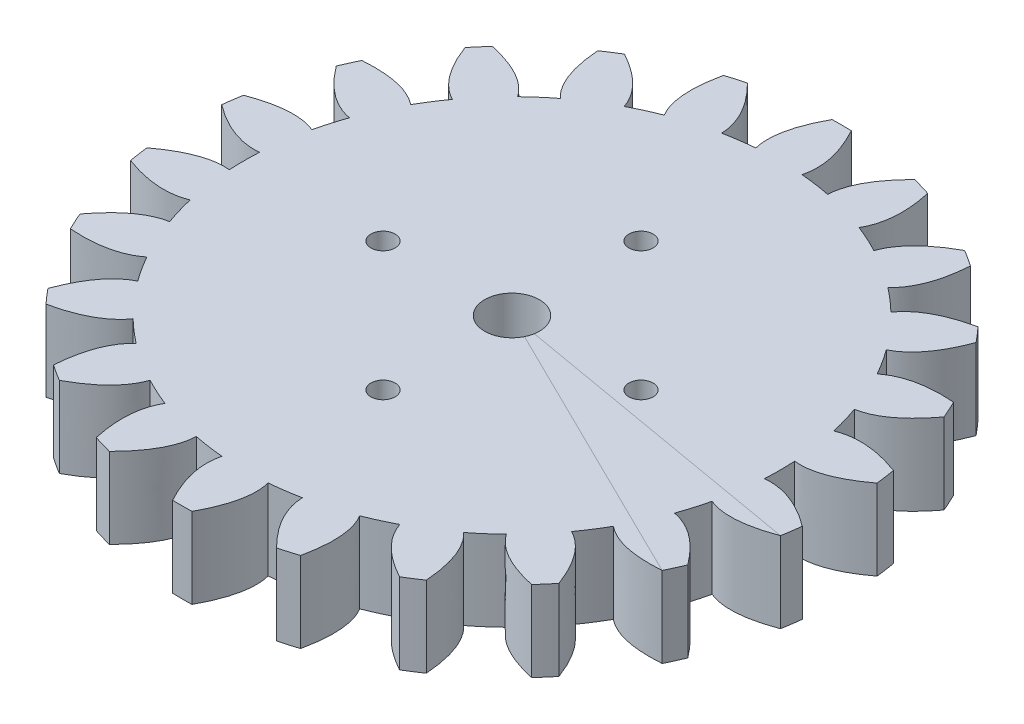
from build123d import *

# Parameters (mm, degrees)
SKETCH_1_W           = 20.454545455
SKETCH_1_H           = 5
CUT_EXTRUDE_1_DEPTH  = 30.356036168
CUT_EXTRUDE_2_DEPTH  = 30.356036325
CUT_EXTRUDE_START    = -10
CUT_EXTRUDE_24_DEPTH = 10
EXTRUDE_1_DEPTH      = 5
SKETCH_30_R          = 10.5
CUT_EXTRUDE_26_DEPTH = 2.5
SKETCH_31_R          = 0.75
SKETCH_31_R_2        = 1.7
CUT_EXTRUDE_27_DEPTH = 2.5
CUT_EXTRUDE_28_DEPTH = 3


with BuildPart() as part:
    # 草图1 → 旋转1 (revolve)
    with BuildSketch(Plane(origin=(0, 0, 0), x_dir=(-1, 0, 0), z_dir=(0, 0, -1)), mode=Mode.PRIVATE) as revolve_1_sk:
        with Locations((-10.227272728, -2.5)):
            Rectangle(SKETCH_1_W, SKETCH_1_H)
    revolve(revolve_1_sk.sketch.rotate(Axis((0, -5, 0), (0, 1, 0)), 270), axis=Axis((0, -5, 0), (0, 1, 0)))

    # 草图2 → 切除-拉伸1 (cut, through all)
    with BuildSketch(Plane(origin=(0, 0, 0), x_dir=(-1, 0, 0), z_dir=(0, 1, 0))):
        with BuildLine():
            ThreePointArc((-16.18506036, 3.774328811), (-15.946119022, 4.682203004), (-15.656295421, 5.575136817))
            add(Edge.make_bspline(
                [(-18.847521886, 7.947285605), (-17.290153908, 5.865702018), (-15.656295421, 5.575136817)],
                knots=[5.954734262, 5.954734262, 5.954734262, 6.237026865, 6.237026865, 6.237026865], degree=2, weights=[1, 0.990055387, 1]))
            ThreePointArc((-18.847521886, 7.947285605), (-19.625992643, 5.762711388), (-20.152171359, 3.504057543))
            add(Edge.make_bspline(
                [(-16.18506036, 3.774328811), (-17.716640991, 4.413220397), (-20.152171359, 3.504057543)],
                knots=[3.187751096, 3.187751096, 3.187751096, 3.470043699, 3.470043699, 3.470043699], degree=2, weights=[1, 0.990055387, 1]))
        make_face()
    extrude(amount=-CUT_EXTRUDE_1_DEPTH, mode=Mode.SUBTRACT)

    # 草图3 → 切除-拉伸2 (cut, through all)
    with BuildSketch(Plane(origin=(0, 0, 0), x_dir=(-1, 0, 0), z_dir=(0, 1, 0))):
        with BuildLine():
            ThreePointArc((-14.466100387, 8.181300412), (-13.981060134, 8.985081767), (-13.451407899, 9.760192742))
            add(Edge.make_bspline(
                [(-15.845055727, 12.935325229), (-14.93722196, 10.49929914), (-13.451407899, 9.760192742)],
                knots=[5.954734262, 5.954734262, 5.954734262, 6.237026865, 6.237026865, 6.237026865], degree=2, weights=[1, 0.990055387, 1]))
            ThreePointArc((-15.845055727, 12.935325229), (-17.207458626, 11.058562175), (-18.348659729, 9.039641359))
            add(Edge.make_bspline(
                [(-14.466100387, 8.181300412), (-15.755644681, 9.225808528), (-18.348659729, 9.039641359)],
                knots=[3.187751096, 3.187751096, 3.187751096, 3.470043698, 3.470043698, 3.470043698], degree=2, weights=[1, 0.990055387, 1]))
        make_face()
    extrude(amount=-CUT_EXTRUDE_2_DEPTH, mode=Mode.SUBTRACT)

    # 草图28 → 切除-拉伸24 (cut)
    with BuildSketch(Plane(origin=(0, 0, 0), x_dir=(1, 0, 0), z_dir=(0, 1, 0)).offset(CUT_EXTRUDE_START)):
        with BuildLine():
            Line((20.152171359, -3.504057543), (0, 0))
            Line((0, 0), (18.348659729, -9.039641359))
            ThreePointArc((18.348659729, -9.039641359), (-19.448371928, 6.3363443), (20.152171359, -3.504057543))
        make_face()
    extrude(amount=CUT_EXTRUDE_24_DEPTH, mode=Mode.SUBTRACT)


with BuildPart() as body_2:
    # 草图29 → 凸台-拉伸1 (new body)
    with BuildSketch(Plane(origin=(0, 0, 0), x_dir=(1, 0, 0), z_dir=(0, 1, 0))):
        with BuildLine():
            Line((0, 0), (20.152171359, -3.504057543))
            ThreePointArc((20.152171359, -3.504057543), (20.246347675, -2.910985324), (20.323073914, -2.315404162))
            add(Edge.make_bspline(
                [(20.323073914, -2.315404162), (18.242340415, -0.756900598), (16.592803, -0.938416459)],
                knots=[5.954734262, 5.954734262, 5.954734262, 6.237026865, 6.237026865, 6.237026865], degree=2, weights=[1, 0.990055387, 1]))
            ThreePointArc((16.592803, -0.938416459), (16.619318182, 4e-09), (16.592803, 0.938416468))
            add(Edge.make_bspline(
                [(16.592803, 0.938416468), (18.242340414, 0.756900608), (20.323073914, 2.315404175)],
                knots=[0.046158443, 0.046158443, 0.046158443, 0.328451045, 0.328451045, 0.328451045], degree=2, weights=[1, 0.990055387, 1]))
            ThreePointArc((20.323073914, 2.315404175), (20.246347675, 2.910985337), (20.152171358, 3.504057557))
            add(Edge.make_bspline(
                [(20.152171358, 3.504057557), (17.716640992, 4.413220407), (16.18506036, 3.77432882)],
                knots=[2.813141609, 2.813141609, 2.813141609, 3.095434211, 3.095434211, 3.095434211], degree=2, weights=[1, 0.990055387, 1]))
            ThreePointArc((16.18506036, 3.77432882), (15.946119021, 4.682203013), (15.656295421, 5.575136826))
            add(Edge.make_bspline(
                [(15.656295421, 5.575136826), (17.290153907, 5.865702027), (18.847521885, 7.947285618)],
                knots=[3.187751096, 3.187751096, 3.187751096, 3.470043699, 3.470043699, 3.470043699], degree=2, weights=[1, 0.990055387, 1]))
            ThreePointArc((18.847521885, 7.947285618), (18.606108994, 8.497125279), (18.348659728, 9.039641372))
            add(Edge.make_bspline(
                [(18.348659728, 9.039641372), (15.755644679, 9.225808541), (14.466100385, 8.181300425)],
                knots=[2.813141609, 2.813141609, 2.813141609, 3.095434211, 3.095434211, 3.095434211], degree=2, weights=[1, 0.990055387, 1]))
            ThreePointArc((14.466100385, 8.181300425), (13.981060132, 8.98508178), (13.451407897, 9.760192755))
            add(Edge.make_bspline(
                [(13.451407897, 9.760192755), (14.937221957, 10.499299153), (15.845055722, 12.935325245)],
                knots=[0.046158443, 0.046158443, 0.046158443, 0.328451045, 0.328451045, 0.328451045], degree=2, weights=[1, 0.990055387, 1]))
            ThreePointArc((15.845055722, 12.935325245), (15.458514016, 13.394878665), (15.058648808, 13.842887204))
            add(Edge.make_bspline(
                [(15.058648808, 13.842887204), (12.518219736, 13.290976535), (11.575182989, 11.925471726)],
                knots=[5.954734262, 5.954734262, 5.954734262, 6.237026865, 6.237026865, 6.237026865], degree=2, weights=[1, 0.990055387, 1]))
            ThreePointArc((11.575182989, 11.925471726), (10.883338897, 12.560042658), (10.156767303, 13.154535914))
            add(Edge.make_bspline(
                [(10.156767303, 13.154535914), (11.374165119, 14.282305504), (11.558917378, 16.87542175)],
                knots=[0.046158443, 0.046158443, 0.046158443, 0.328451045, 0.328451045, 0.328451045], degree=2, weights=[1, 0.990055387, 1]))
            ThreePointArc((11.558917378, 16.87542175), (11.058562167, 17.207458644), (10.548675718, 17.524664643))
            add(Edge.make_bspline(
                [(10.548675718, 17.524664643), (8.266643078, 16.279388656), (7.746513106, 14.703512232)],
                knots=[5.954734262, 5.954734262, 5.954734262, 6.237026865, 6.237026865, 6.237026865], degree=2, weights=[1, 0.990055387, 1]))
            ThreePointArc((7.746513106, 14.703512232), (6.90391427, 15.117463577), (6.039285825, 15.483176807))
            add(Edge.make_bspline(
                [(6.039285825, 15.483176807), (6.889641066, 16.908244403), (6.33634429, 19.448371948)],
                knots=[0.046158443, 0.046158443, 0.046158443, 0.328451045, 0.328451045, 0.328451045], degree=2, weights=[1, 0.990055387, 1]))
            ThreePointArc((6.33634429, 19.448371948), (5.762711378, 19.625992662), (5.184111655, 19.786697975))
            add(Edge.make_bspline(
                [(5.184111655, 19.786697975), (3.345352159, 17.948941525), (3.2902668, 16.290361622)],
                knots=[5.954734262, 5.954734262, 5.954734262, 6.237026865, 6.237026865, 6.237026865], degree=2, weights=[1, 0.990055387, 1]))
            ThreePointArc((3.2902668, 16.290361622), (2.365175567, 16.450157505), (1.432537326, 16.557462797))
            add(Edge.make_bspline(
                [(1.432537326, 16.557462797), (1.846959267, 18.164377898), (0.60043827, 20.445730714)],
                knots=[3.187751096, 3.187751096, 3.187751096, 3.470043699, 3.470043699, 3.470043699], degree=2, weights=[1, 0.990055387, 1]))
            ThreePointArc((0.60043827, 20.445730714), (-1.7e-08, 20.454545474), (-0.600438303, 20.445730714))
            add(Edge.make_bspline(
                [(-0.600438303, 20.445730714), (-1.846959297, 18.164377899), (-1.432537355, 16.557462797)],
                knots=[5.954734262, 5.954734262, 5.954734262, 6.237026865, 6.237026865, 6.237026865], degree=2, weights=[1, 0.990055387, 1]))
            ThreePointArc((-1.432537355, 16.557462797), (-2.365175596, 16.450157505), (-3.290266829, 16.290361622))
            add(Edge.make_bspline(
                [(-3.290266829, 16.290361622), (-3.345352189, 17.948941525), (-5.184111689, 19.786697974)],
                knots=[0.046158443, 0.046158443, 0.046158443, 0.328451045, 0.328451045, 0.328451045], degree=2, weights=[1, 0.990055387, 1]))
            ThreePointArc((-5.184111689, 19.786697974), (-5.762711411, 19.625992661), (-6.336344323, 19.448371947))
            add(Edge.make_bspline(
                [(-6.336344323, 19.448371947), (-6.889641096, 16.908244403), (-6.039285855, 15.483176807)],
                knots=[5.954734262, 5.954734262, 5.954734262, 6.237026865, 6.237026865, 6.237026865], degree=2, weights=[1, 0.990055387, 1]))
            ThreePointArc((-6.039285855, 15.483176807), (-6.903914299, 15.117463578), (-7.746513135, 14.703512232))
            add(Edge.make_bspline(
                [(-7.746513135, 14.703512232), (-8.266643107, 16.279388655), (-10.548675751, 17.524664641)],
                knots=[0.046158443, 0.046158443, 0.046158443, 0.328451045, 0.328451045, 0.328451045], degree=2, weights=[1, 0.990055387, 1]))
            ThreePointArc((-10.548675751, 17.524664641), (-11.0585622, 17.207458642), (-11.558917411, 16.875421748))
            add(Edge.make_bspline(
                [(-11.558917411, 16.875421748), (-11.374165149, 14.282305504), (-10.156767332, 13.154535915)],
                knots=[2.813141609, 2.813141609, 2.813141609, 3.095434211, 3.095434211, 3.095434211], degree=2, weights=[1, 0.990055387, 1]))
            ThreePointArc((-10.156767332, 13.154535915), (-10.883338927, 12.560042658), (-11.575183018, 11.925471727))
            add(Edge.make_bspline(
                [(-11.575183018, 11.925471727), (-12.518219766, 13.290976535), (-15.05864884, 13.842887201)],
                knots=[0.046158443, 0.046158443, 0.046158443, 0.328451045, 0.328451045, 0.328451045], degree=2, weights=[1, 0.990055387, 1]))
            ThreePointArc((-15.05864884, 13.842887201), (-15.458514048, 13.394878662), (-15.845055754, 12.935325242))
            add(Edge.make_bspline(
                [(-15.845055754, 12.935325242), (-14.937221988, 10.499299153), (-13.451407926, 9.760192756)],
                knots=[5.954734262, 5.954734262, 5.954734262, 6.237026865, 6.237026865, 6.237026865], degree=2, weights=[1, 0.990055387, 1]))
            ThreePointArc((-13.451407926, 9.760192756), (-13.981060161, 8.985081781), (-14.466100414, 8.181300426))
            add(Edge.make_bspline(
                [(-14.466100414, 8.181300426), (-15.755644709, 9.22580854), (-18.348659759, 9.039641368)],
                knots=[0.046158443, 0.046158443, 0.046158443, 0.328451045, 0.328451045, 0.328451045], degree=2, weights=[1, 0.990055387, 1]))
            ThreePointArc((-18.348659759, 9.039641368), (-18.606109025, 8.497125275), (-18.847521916, 7.947285615))
            add(Edge.make_bspline(
                [(-18.847521916, 7.947285615), (-17.290153937, 5.865702027), (-15.65629545, 5.575136826)],
                knots=[5.954734262, 5.954734262, 5.954734262, 6.237026865, 6.237026865, 6.237026865], degree=2, weights=[1, 0.990055387, 1]))
            ThreePointArc((-15.65629545, 5.575136826), (-15.946119051, 4.682203014), (-16.18506039, 3.77432882))
            add(Edge.make_bspline(
                [(-16.18506039, 3.77432882), (-17.716641021, 4.413220406), (-20.152171389, 3.504057553)],
                knots=[0.046158443, 0.046158443, 0.046158443, 0.328451045, 0.328451045, 0.328451045], degree=2, weights=[1, 0.990055387, 1]))
            ThreePointArc((-20.152171389, 3.504057553), (-20.246347705, 2.910985333), (-20.323073944, 2.315404171))
            add(Edge.make_bspline(
                [(-20.323073944, 2.315404171), (-18.242340445, 0.756900608), (-16.59280303, 0.938416468)],
                knots=[2.813141609, 2.813141609, 2.813141609, 3.095434211, 3.095434211, 3.095434211], degree=2, weights=[1, 0.990055387, 1]))
            ThreePointArc((-16.59280303, 0.938416468), (-16.619318212, 5e-09), (-16.59280303, -0.938416458))
            add(Edge.make_bspline(
                [(-16.59280303, -0.938416458), (-18.242340444, -0.756900598), (-20.323073943, -2.315404166)],
                knots=[3.187751096, 3.187751096, 3.187751096, 3.470043699, 3.470043699, 3.470043699], degree=2, weights=[1, 0.990055387, 1]))
            ThreePointArc((-20.323073943, -2.315404166), (-20.246347705, -2.910985328), (-20.152171388, -3.504057547))
            add(Edge.make_bspline(
                [(-20.152171388, -3.504057547), (-17.716641022, -4.413220397), (-16.18506039, -3.774328811)],
                knots=[2.813141609, 2.813141609, 2.813141609, 3.095434211, 3.095434211, 3.095434211], degree=2, weights=[1, 0.990055387, 1]))
            ThreePointArc((-16.18506039, -3.774328811), (-15.946119052, -4.682203004), (-15.65629545, -5.575136817))
            add(Edge.make_bspline(
                [(-15.65629545, -5.575136817), (-17.290153937, -5.865702018), (-18.847521915, -7.947285609)],
                knots=[0.046158443, 0.046158443, 0.046158443, 0.328451045, 0.328451045, 0.328451045], degree=2, weights=[1, 0.990055387, 1]))
            ThreePointArc((-18.847521915, -7.947285609), (-18.606109024, -8.497125269), (-18.348659757, -9.039641362))
            add(Edge.make_bspline(
                [(-18.348659757, -9.039641362), (-15.755644709, -9.225808531), (-14.466100415, -8.181300416)],
                knots=[5.954734262, 5.954734262, 5.954734262, 6.237026865, 6.237026865, 6.237026865], degree=2, weights=[1, 0.990055387, 1]))
            ThreePointArc((-14.466100415, -8.181300416), (-13.981060162, -8.985081771), (-13.451407927, -9.760192746))
            add(Edge.make_bspline(
                [(-13.451407927, -9.760192746), (-14.937221987, -10.499299143), (-15.845055752, -12.935325236)],
                knots=[0.046158443, 0.046158443, 0.046158443, 0.328451045, 0.328451045, 0.328451045], degree=2, weights=[1, 0.990055387, 1]))
            ThreePointArc((-15.845055752, -12.935325236), (-15.458514046, -13.394878656), (-15.058648838, -13.842887195))
            add(Edge.make_bspline(
                [(-15.058648838, -13.842887195), (-12.518219766, -13.290976526), (-11.575183018, -11.925471717)],
                knots=[5.954734262, 5.954734262, 5.954734262, 6.237026865, 6.237026865, 6.237026865], degree=2, weights=[1, 0.990055387, 1]))
            ThreePointArc((-11.575183018, -11.925471717), (-10.883338928, -12.560042649), (-10.156767333, -13.154535905))
            add(Edge.make_bspline(
                [(-10.156767333, -13.154535905), (-11.374165149, -14.282305494), (-11.558917407, -16.875421741)],
                knots=[3.187751096, 3.187751096, 3.187751096, 3.470043699, 3.470043699, 3.470043699], degree=2, weights=[1, 0.990055387, 1]))
            ThreePointArc((-11.558917407, -16.875421741), (-11.058562197, -17.207458636), (-10.548675748, -17.524664633))
            add(Edge.make_bspline(
                [(-10.548675748, -17.524664633), (-8.266643107, -16.279388647), (-7.746513135, -14.703512223)],
                knots=[5.954734262, 5.954734262, 5.954734262, 6.237026865, 6.237026865, 6.237026865], degree=2, weights=[1, 0.990055387, 1]))
            ThreePointArc((-7.746513135, -14.703512223), (-6.903914301, -15.117463569), (-6.039285855, -15.483176797))
            add(Edge.make_bspline(
                [(-6.039285855, -15.483176797), (-6.889641096, -16.908244394), (-6.33634432, -19.448371938)],
                knots=[0.046158443, 0.046158443, 0.046158443, 0.328451045, 0.328451045, 0.328451045], degree=2, weights=[1, 0.990055387, 1]))
            ThreePointArc((-6.33634432, -19.448371938), (-5.762711407, -19.625992653), (-5.184111685, -19.786697966))
            add(Edge.make_bspline(
                [(-5.184111685, -19.786697966), (-3.345352189, -17.948941516), (-3.29026683, -16.290361613)],
                knots=[5.954734262, 5.954734262, 5.954734262, 6.237026865, 6.237026865, 6.237026865], degree=2, weights=[1, 0.990055387, 1]))
            ThreePointArc((-3.29026683, -16.290361613), (-2.365175597, -16.450157497), (-1.432537356, -16.557462787))
            add(Edge.make_bspline(
                [(-1.432537356, -16.557462787), (-1.846959296, -18.164377889), (-0.6004383, -20.445730705)],
                knots=[3.187751096, 3.187751096, 3.187751096, 3.470043699, 3.470043699, 3.470043699], degree=2, weights=[1, 0.990055387, 1]))
            ThreePointArc((-0.6004383, -20.445730705), (-1.3e-08, -20.454545466), (0.600438274, -20.445730705))
            add(Edge.make_bspline(
                [(0.600438274, -20.445730705), (1.846959267, -18.16437789), (1.432537325, -16.557462787)],
                knots=[5.954734262, 5.954734262, 5.954734262, 6.237026865, 6.237026865, 6.237026865], degree=2, weights=[1, 0.990055387, 1]))
            ThreePointArc((1.432537325, -16.557462787), (2.365175566, -16.450157497), (3.290266799, -16.290361613))
            add(Edge.make_bspline(
                [(3.290266799, -16.290361613), (3.345352159, -17.948941515), (5.184111659, -19.786697965)],
                knots=[0.046158443, 0.046158443, 0.046158443, 0.328451045, 0.328451045, 0.328451045], degree=2, weights=[1, 0.990055387, 1]))
            ThreePointArc((5.184111659, -19.786697965), (5.762711381, -19.625992652), (6.336344293, -19.448371937))
            add(Edge.make_bspline(
                [(6.336344293, -19.448371937), (6.889641066, -16.908244394), (6.039285825, -15.483176798)],
                knots=[5.954734262, 5.954734262, 5.954734262, 6.237026865, 6.237026865, 6.237026865], degree=2, weights=[1, 0.990055387, 1]))
            ThreePointArc((6.039285825, -15.483176798), (6.90391427, -15.117463569), (7.746513105, -14.703512223))
            add(Edge.make_bspline(
                [(7.746513105, -14.703512223), (8.266643078, -16.279388646), (10.548675721, -17.524664631)],
                knots=[0.046158443, 0.046158443, 0.046158443, 0.328451045, 0.328451045, 0.328451045], degree=2, weights=[1, 0.990055387, 1]))
            ThreePointArc((10.548675721, -17.524664631), (11.05856217, -17.207458634), (11.558917381, -16.875421739))
            add(Edge.make_bspline(
                [(11.558917381, -16.875421739), (11.374165119, -14.282305495), (10.156767303, -13.154535905)],
                knots=[5.954734262, 5.954734262, 5.954734262, 6.237026865, 6.237026865, 6.237026865], degree=2, weights=[1, 0.990055387, 1]))
            ThreePointArc((10.156767303, -13.154535905), (10.883338898, -12.56004265), (11.575182988, -11.925471717))
            add(Edge.make_bspline(
                [(11.575182988, -11.925471717), (12.518219736, -13.290976525), (15.05864881, -13.842887192)],
                knots=[0.046158443, 0.046158443, 0.046158443, 0.328451045, 0.328451045, 0.328451045], degree=2, weights=[1, 0.990055387, 1]))
            ThreePointArc((15.05864881, -13.842887192), (15.458514019, -13.394878653), (15.845055725, -12.935325233))
            add(Edge.make_bspline(
                [(15.845055725, -12.935325233), (14.937221958, -10.499299144), (13.451407897, -9.760192746)],
                knots=[2.813141609, 2.813141609, 2.813141609, 3.095434211, 3.095434211, 3.095434211], degree=2, weights=[1, 0.990055387, 1]))
            ThreePointArc((13.451407897, -9.760192746), (13.981060132, -8.985081771), (14.466100385, -8.181300416))
            add(Edge.make_bspline(
                [(14.466100385, -8.181300416), (15.755644679, -9.225808531), (18.348659729, -9.039641359)],
                knots=[0.046158443, 0.046158443, 0.046158443, 0.328451045, 0.328451045, 0.328451045], degree=2, weights=[1, 0.990055387, 1]))
            Line((18.348659729, -9.039641359), (0, 0))
        make_face()
    extrude(amount=-EXTRUDE_1_DEPTH)


with BuildPart() as cut_extrude_26_tool:
    # 草图30 → 切除-拉伸26 (new body)
    with BuildSketch(Plane.XZ.offset(5)):
        Circle(SKETCH_30_R)
    extrude(amount=-CUT_EXTRUDE_26_DEPTH)


with BuildPart() as part_1:
    add(part.part)

    # 切除-拉伸26: cut by cut_extrude_26_tool
    add(cut_extrude_26_tool.part, mode=Mode.SUBTRACT)

    # 草图32 → 切除-拉伸28 (cut)
    with BuildSketch(Plane.XZ.offset(2.5)):
        with BuildLine():
            Line((1.524977497, 0.751294637), (0, 0))
            Line((0, 0), (1.674869353, 0.291226116))
            ThreePointArc((1.674869353, 0.291226116), (1.6163758, 0.526620615), (1.524977497, 0.751294637))
        make_face()
    extrude(amount=-CUT_EXTRUDE_28_DEPTH, mode=Mode.SUBTRACT)


with BuildPart() as body_2_1:
    add(body_2.part)

    # 切除-拉伸26: cut by cut_extrude_26_tool
    add(cut_extrude_26_tool.part, mode=Mode.SUBTRACT)

    # 草图31 → 切除-拉伸27 (cut)
    with BuildSketch(Plane.XZ.offset(2.5)):
        with Locations(Location((0, 8, 0), (0, 0, 270))):
            Circle(SKETCH_31_R)
        with Locations(Location((8, 0, 0), (0, 0, 270))):
            Circle(SKETCH_31_R)
        with Locations(Location((0, -8, 0), (0, 0, 270))):
            Circle(SKETCH_31_R)
        with Locations(Location((-8, 0, 0), (0, 0, 270))):
            Circle(SKETCH_31_R)
        Circle(SKETCH_31_R_2)
    extrude(amount=-CUT_EXTRUDE_27_DEPTH, mode=Mode.SUBTRACT)


solid = Compound([part_1.part, body_2_1.part])
